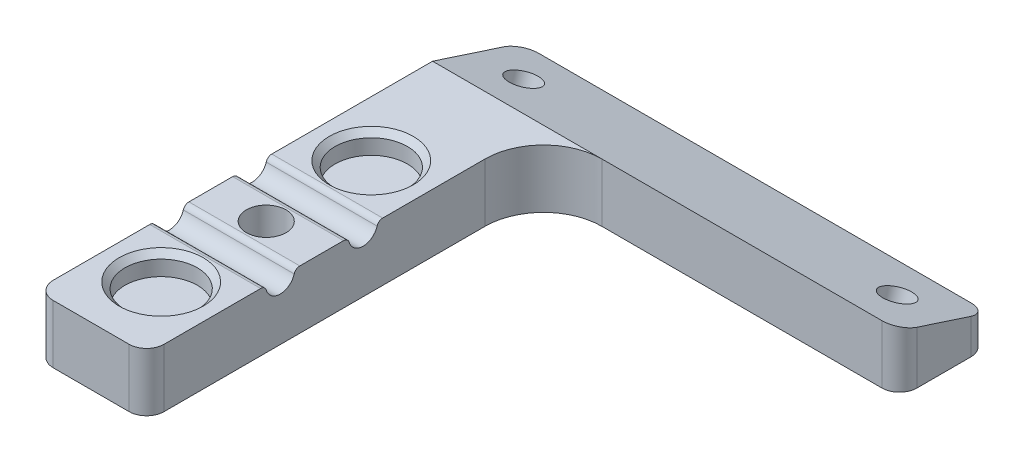
from build123d import *

# Parameters (mm, degrees)
SKETCH1_W           = 9.5
SKETCH1_H           = 30
BOSS_EXTRUDE1_DEPTH = 5
SKETCH2_R           = 3.1
SKETCH2_R_2         = 1.7
CUT_EXTRUDE1_DEPTH  = 17.509466981
BOSS_EXTRUDE3_START = -3.2
SKETCH8_R           = 3.1
BOSS_EXTRUDE3_DEPTH = 3.2
CHAMFER1_SIZE       = 0.5
BOSS_EXTRUDE2_DEPTH = 5
CUT_EXTRUDE2_DEPTH  = 50.658836072
SKETCH6_R           = 1.3
CUT_EXTRUDE3_DEPTH  = 45.788689937
SKETCH9_W           = 2.39154787
SKETCH9_H           = 2.527864045
CUT_EXTRUDE4_DEPTH  = 50.658836072
FILLET2_R           = 1.5
FILLET1_R           = 5
SKETCH10_R          = 3.25
CUT_EXTRUDE5_DEPTH  = 2
SKETCH13_R          = 1.25
CUT_EXTRUDE6_DEPTH  = 49.301239371
FILLET3_R           = 0.5


with BuildPart() as part:
    # Sketch1 → Boss-Extrude1 (new body)
    with BuildSketch(Plane(origin=(0, 0, 0), x_dir=(1, 0, 0), z_dir=(0, 1, 0))):
        Rectangle(SKETCH1_W, SKETCH1_H)
    extrude(amount=BOSS_EXTRUDE1_DEPTH)

    # Sketch2 → Cut-Extrude1 (cut, through all)
    with BuildSketch(Plane(origin=(0, 5, 0), x_dir=(1, 0, 0), z_dir=(0, 1, 0))):
        with Locations(Location((0, 9, 0), (0, 0, 270))):
            Circle(SKETCH2_R)
        with Locations(Location((0, 0, 0), (0, 0, 270))):
            Circle(SKETCH2_R_2)
        with Locations(Location((0, -9, 0), (0, 0, 270))):
            Circle(SKETCH2_R)
    extrude(amount=-CUT_EXTRUDE1_DEPTH, mode=Mode.SUBTRACT)

    # Sketch8 → Boss-Extrude3 (add)
    with BuildSketch(Plane.XZ.offset(BOSS_EXTRUDE3_START)):
        with Locations(Location((0, 9, 0), (0, 0, 90))):
            Circle(SKETCH8_R)
        with Locations(Location((0, -9, 0), (0, 0, 90))):
            Circle(SKETCH8_R)
    extrude(amount=BOSS_EXTRUDE3_DEPTH)

    # Chamfer1
    chamfer1_edges = [part.edges().sort_by_distance(p)[0] for p in [
        (0, 5, -12.1),
        (0, 5, 5.9),
    ]]
    chamfer(chamfer1_edges, length=CHAMFER1_SIZE)

    # Sketch3 → Boss-Extrude2 (add)
    with BuildSketch(Plane(origin=(0, 5, 0), x_dir=(1, 0, 0), z_dir=(0, 1, 0))):
        Polygon((-4.75, 15), (-4.75, 19), (-4.75, 29), (35.25, 29), (35.25, 19), (4.75, 19), (4.75, 15), align=None)
    extrude(amount=-BOSS_EXTRUDE2_DEPTH)

    # Sketch5 → Cut-Extrude2 (cut, through all)
    with BuildSketch(Plane(origin=(35.25, 0, 0), x_dir=(0, 0, -1), z_dir=(1, 0, 0))):
        Polygon((19, 5), (29, 1.750803038), (29, 5), align=None)
    extrude(amount=-CUT_EXTRUDE2_DEPTH, mode=Mode.SUBTRACT)

    # Sketch6 → Cut-Extrude3 (cut, through all)
    with BuildSketch(Plane(origin=(0, 10.106502383, -3.283801684), x_dir=(1, 0, 0), z_dir=(0, 0.9510565162951556, -0.30901699437494123))):
        with Locations(Location((-0.75, 20.524988838, 0), (0, 0, 270))):
            Circle(SKETCH6_R)
        with Locations(Location((31.25, 20.524988838, 0), (0, 0, 270))):
            Circle(SKETCH6_R)
    extrude(amount=-CUT_EXTRUDE3_DEPTH, mode=Mode.SUBTRACT)

    # Sketch9 → Cut-Extrude4 (cut, through all)
    with BuildSketch(Plane(origin=(35.25, 0, 0), x_dir=(0, 0, -1), z_dir=(1, 0, 0))):
        with Locations((27.804226065, 1.263932023)):
            Rectangle(SKETCH9_W, SKETCH9_H)
    extrude(amount=-CUT_EXTRUDE4_DEPTH, mode=Mode.SUBTRACT)

    # Fillet2
    fillet2_edges = [part.edges().sort_by_distance(p)[0] for p in [
        (35.25, 2.5, -19),
        (4.75, 2.5, 15),
        (-4.75, 2.5, 15),
        (35.25, 1.263932023, -26.60845213),
        (-4.75, 1.263932023, -26.60845213),
    ]]
    fillet(fillet2_edges, radius=FILLET2_R)

    # Fillet1
    fillet1_edges = [part.edges().sort_by_distance(p)[0] for p in [
        (4.75, 2.5, -19),
    ]]
    fillet(fillet1_edges, radius=FILLET1_R)

    # Sketch10 → Cut-Extrude5 (cut)
    with BuildSketch(Plane.XZ):
        with Locations(Location((0, 0, 0), (0, 0, 270))):
            Circle(SKETCH10_R)
    extrude(amount=-CUT_EXTRUDE5_DEPTH, mode=Mode.SUBTRACT)

    # Sketch13 → Cut-Extrude6 (cut, through all)
    with BuildSketch(Plane.ZY.offset(4.75)):
        with Locations((-3.55, 5)):
            Circle(SKETCH13_R)
        with Locations((3.55, 5)):
            Circle(SKETCH13_R)
    extrude(amount=-CUT_EXTRUDE6_DEPTH, mode=Mode.SUBTRACT)

    # Fillet3
    fillet3_edges = [part.edges().sort_by_distance(p)[0] for p in [
        (0, 5, -4.8),
        (0, 5, -2.3),
        (0, 5, 4.8),
        (0, 5, 2.3),
    ]]
    fillet(fillet3_edges, radius=FILLET3_R)


solid = part.part
